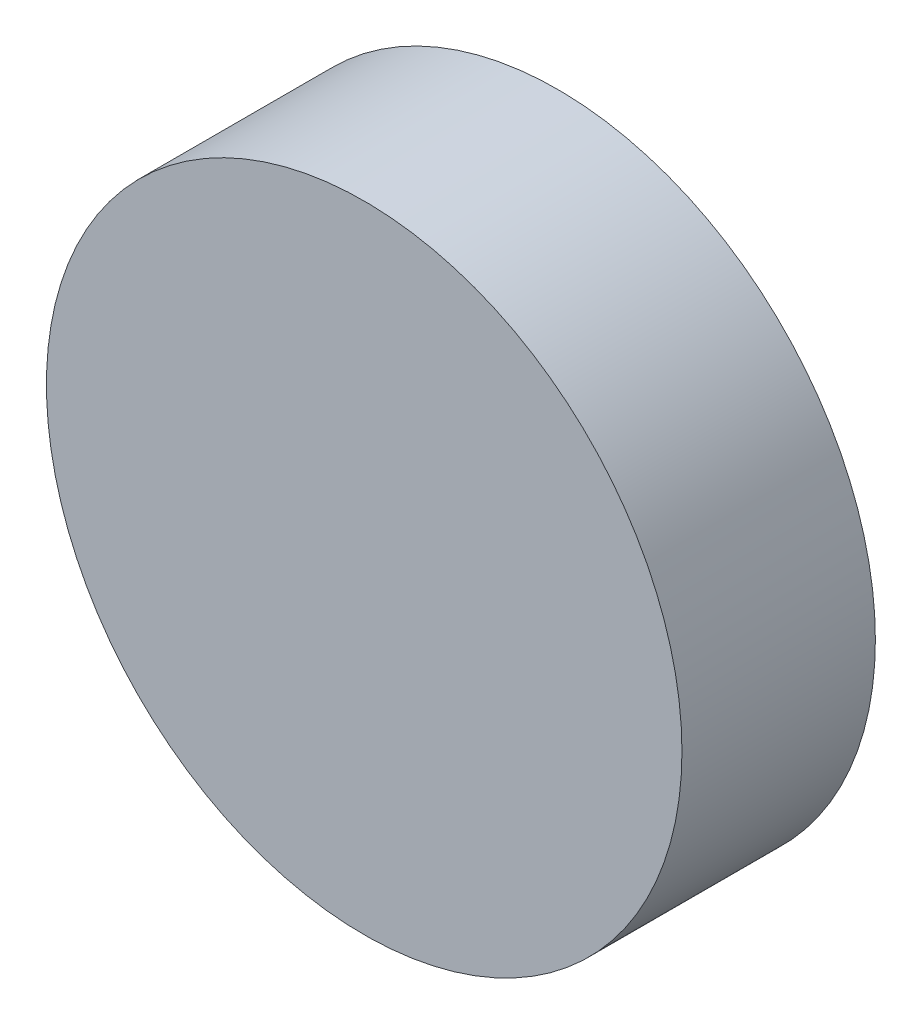
from build123d import *

# Parameters (mm, degrees)
SKETCH1_R           = 46
BOSS_EXTRUDE1_DEPTH = 28
SKETCH4_R           = 1.5
CUT_EXTRUDE1_DEPTH  = 5
SKETCH2_R           = 10
BOSS_EXTRUDE2_DEPTH = 2


with BuildPart() as part:
    # Sketch1 → Boss-Extrude1 (new body)
    with BuildSketch(Plane.XY):
        Circle(SKETCH1_R)
    extrude(amount=BOSS_EXTRUDE1_DEPTH)

    # Sketch4 → Cut-Extrude1 (cut)
    with BuildSketch(Plane(origin=(0, 0, 0), x_dir=(-1, 0, 0), z_dir=(0, 0, -1))):
        with Locations((-14.142135624, 14.142135624)):
            Circle(SKETCH4_R)
        with Locations((14.142135624, 14.142135624)):
            Circle(SKETCH4_R)
        with Locations((-14.142135624, -14.142135624)):
            Circle(SKETCH4_R)
        with Locations((14.142135624, -14.142135624)):
            Circle(SKETCH4_R)
    extrude(amount=-CUT_EXTRUDE1_DEPTH, mode=Mode.SUBTRACT)

    # Sketch2 → Boss-Extrude2 (add)
    with BuildSketch(Plane(origin=(0, 0, 0), x_dir=(-1, 0, 0), z_dir=(0, 0, -1))):
        with Locations(Location((0, 0, 0), (0, 0, 180))):
            Circle(SKETCH2_R)
    extrude(amount=BOSS_EXTRUDE2_DEPTH)


solid = part.part
